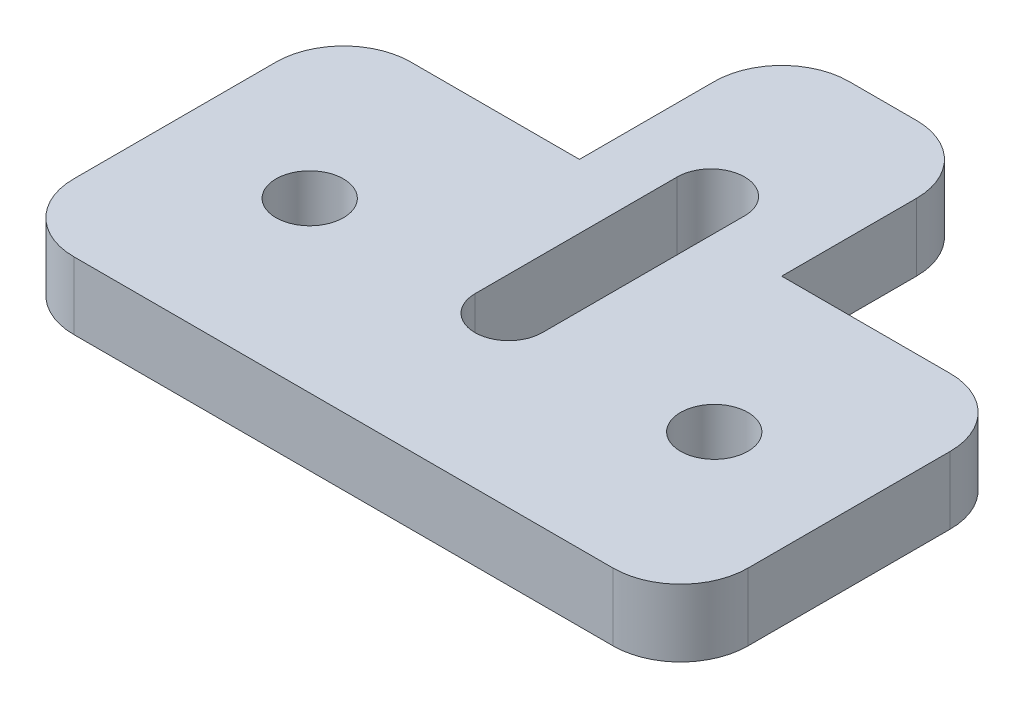
from build123d import *

# Parameters (mm, degrees)
BOSS_EXTRUDE1_DEPTH = 10
SKETCH2_R           = 5
CUT_EXTRUDE1_DEPTH  = 26
FILLET4_R           = 10
FILLET5_R           = 10
FILLET6_R           = 10
FILLET7_R           = 10
CUT_EXTRUDE2_DEPTH  = 26
FILLET9_R           = 10
CUT_EXTRUDE3_DEPTH  = 31
CUT_EXTRUDE5_DEPTH  = 32
FILLET10_R          = 10
FILLET11_R          = 10
FILLET12_R          = 10
FILLET13_R          = 10


with BuildPart() as part:
    # Sketch1 → Boss-Extrude1 (new body)
    with BuildSketch(Plane(origin=(0, 0, 0), x_dir=(1, 0, 0), z_dir=(0, 1, 0))):
        Polygon((0, 0), (-130, 0), (-130, 50), (-80, 50), (-80, 80), (-50, 80), (-50, 50), (0, 50), align=None)
    extrude(amount=BOSS_EXTRUDE1_DEPTH)

    # Sketch2 → Cut-Extrude1 (cut)
    with BuildSketch(Plane(origin=(0, 10, 0), x_dir=(1, 0, 0), z_dir=(0, 1, 0))):
        with Locations(Location((-95, 25, 0), (0, 0, 270))):
            Circle(SKETCH2_R)
        with Locations(Location((-35, 25, 0), (0, 0, 270))):
            Circle(SKETCH2_R)
    extrude(amount=-CUT_EXTRUDE1_DEPTH, mode=Mode.SUBTRACT)

    # Fillet4
    fillet4_edges = [part.edges().sort_by_distance(p)[0] for p in [
        (-130, 5, -50),
        (-80, 5, -80),
    ]]
    fillet(fillet4_edges, radius=FILLET4_R)

    # Fillet5
    fillet5_edges = [part.edges().sort_by_distance(p)[0] for p in [
        (-50, 5, -80),
    ]]
    fillet(fillet5_edges, radius=FILLET5_R)

    # Fillet6
    fillet6_edges = [part.edges().sort_by_distance(p)[0] for p in [
        (0, 5, -50),
    ]]
    fillet(fillet6_edges, radius=FILLET6_R)

    # Fillet7
    fillet7_edges = [part.edges().sort_by_distance(p)[0] for p in [
        (0, 5, 0),
    ]]
    fillet(fillet7_edges, radius=FILLET7_R)

    # Sketch3 → Cut-Extrude2 (cut)
    with BuildSketch(Plane(origin=(0, 10, 0), x_dir=(1, 0, 0), z_dir=(0, 1, 0))):
        with BuildLine():
            Line((-70.493261523, 55), (-70.493261523, 25))
            ThreePointArc((-70.493261523, 25), (-65.493261523, 20), (-60.493261523, 25))
            Line((-60.493261523, 25), (-60.493261523, 55))
            ThreePointArc((-60.493261523, 55), (-65.493261523, 60), (-70.493261523, 55))
        make_face()
    extrude(amount=-CUT_EXTRUDE2_DEPTH, mode=Mode.SUBTRACT)

    # Fillet9
    fillet9_edges = [part.edges().sort_by_distance(p)[0] for p in [
        (-130, 5, 0),
    ]]
    fillet(fillet9_edges, radius=FILLET9_R)

    # Sketch5 → Cut-Extrude3 (cut)
    with BuildSketch(Plane(origin=(0, 10, 0), x_dir=(1, 0, 0), z_dir=(0, 1, 0))):
        with BuildLine():
            Line((-115, 0), (-115, 50))
            Line((-115, 50), (-120, 50))
            ThreePointArc((-120, 50), (-127.071067812, 47.071067812), (-130, 40))
            Line((-130, 40), (-130, 10))
            ThreePointArc((-130, 10), (-127.071067812, 2.928932188), (-120, 0))
            Line((-120, 0), (-115, 0))
        make_face()
    extrude(amount=-CUT_EXTRUDE3_DEPTH, mode=Mode.SUBTRACT)

    # Sketch6 → Cut-Extrude5 (cut)
    with BuildSketch(Plane(origin=(0, 10, 0), x_dir=(1, 0, 0), z_dir=(0, 1, 0))):
        with BuildLine():
            Line((-10, 50), (-15, 50))
            Line((-15, 50), (-15, 0))
            Line((-15, 0), (-10, 0))
            ThreePointArc((-10, 0), (-2.928932188, 2.928932188), (0, 10))
            Line((0, 10), (0, 40))
            ThreePointArc((0, 40), (-2.928932188, 47.071067812), (-10, 50))
        make_face()
    extrude(amount=-CUT_EXTRUDE5_DEPTH, mode=Mode.SUBTRACT)

    # Fillet10
    fillet10_edges = [part.edges().sort_by_distance(p)[0] for p in [
        (-15, 5, -50),
    ]]
    fillet(fillet10_edges, radius=FILLET10_R)

    # Fillet11
    fillet11_edges = [part.edges().sort_by_distance(p)[0] for p in [
        (-115, 5, -50),
    ]]
    fillet(fillet11_edges, radius=FILLET11_R)

    # Fillet12
    fillet12_edges = [part.edges().sort_by_distance(p)[0] for p in [
        (-15, 5, 0),
    ]]
    fillet(fillet12_edges, radius=FILLET12_R)

    # Fillet13
    fillet13_edges = [part.edges().sort_by_distance(p)[0] for p in [
        (-115, 5, 0),
    ]]
    fillet(fillet13_edges, radius=FILLET13_R)


solid = part.part
